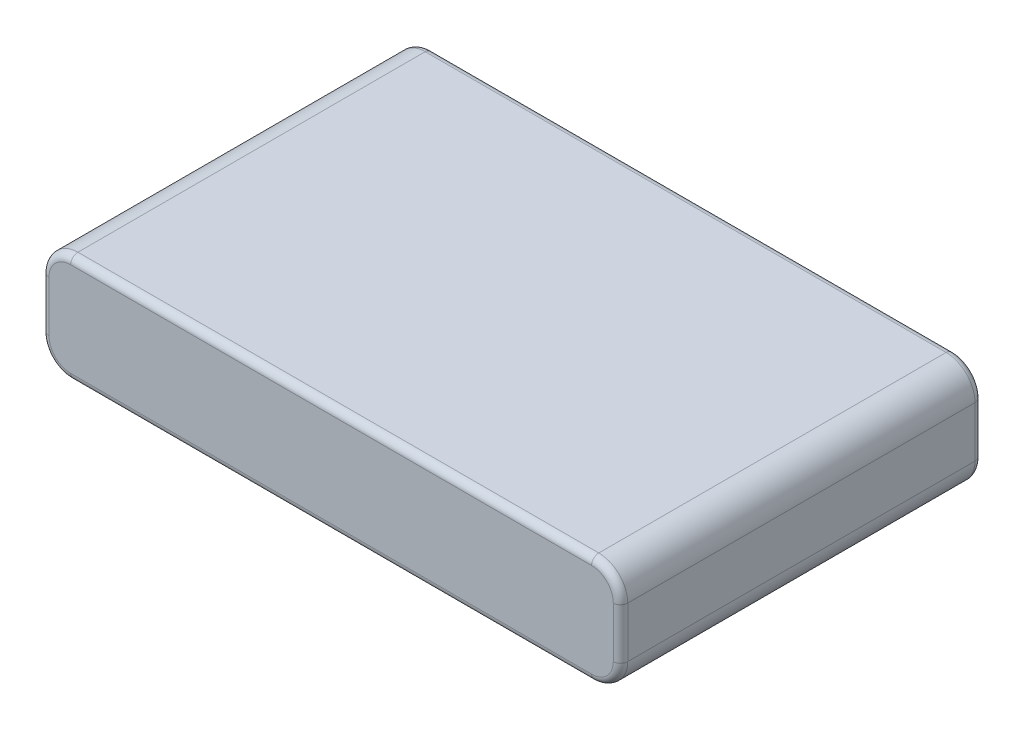
from build123d import *

# Parameters (mm, degrees)
SKETCH1_W           = 40
SKETCH1_H           = 25
BOSS_EXTRUDE1_DEPTH = 7.5
FILLET2_R           = 2
FILLET3_R           = 2
FILLET4_R           = 2
FILLET5_R           = 0.5
FILLET6_R           = 0.5


with BuildPart() as part:
    # Sketch1 → Boss-Extrude1 (new body)
    with BuildSketch(Plane(origin=(0, 0, 0), x_dir=(1, 0, 0), z_dir=(0, 1, 0))):
        with Locations((20, 12.5)):
            Rectangle(SKETCH1_W, SKETCH1_H)
    extrude(amount=BOSS_EXTRUDE1_DEPTH)

    # Fillet2
    fillet2_edges = [part.edges().sort_by_distance(p)[0] for p in [
        (40, 7.5, -12.5),
    ]]
    fillet(fillet2_edges, radius=FILLET2_R)

    # Fillet3
    fillet3_edges = [part.edges().sort_by_distance(p)[0] for p in [
        (40, 0, -12.5),
    ]]
    fillet(fillet3_edges, radius=FILLET3_R)

    # Fillet4
    fillet4_edges = [part.edges().sort_by_distance(p)[0] for p in [
        (0, 7.5, -12.5),
        (0, 0, -12.5),
    ]]
    fillet(fillet4_edges, radius=FILLET4_R)

    # Fillet5
    fillet5_edges = [part.edges().sort_by_distance(p)[0] for p in [
        (40, 3.75, 0),
        (39.414213562, 6.914213562, 0),
        (39.414213562, 0.585786438, 0),
        (0, 3.75, 0),
        (20, 0, 0),
        (20, 7.5, 0),
        (0.585786438, 6.914213562, 0),
        (0.585786438, 0.585786438, 0),
    ]]
    fillet(fillet5_edges, radius=FILLET5_R)

    # Fillet6
    fillet6_edges = [part.edges().sort_by_distance(p)[0] for p in [
        (20, 7.5, -25),
        (40, 3.75, -25),
        (39.414213562, 6.914213562, -25),
        (20, 0, -25),
        (39.414213562, 0.585786438, -25),
        (0, 3.75, -25),
        (0.585786438, 6.914213562, -25),
        (0.585786438, 0.585786438, -25),
    ]]
    fillet(fillet6_edges, radius=FILLET6_R)


solid = part.part
